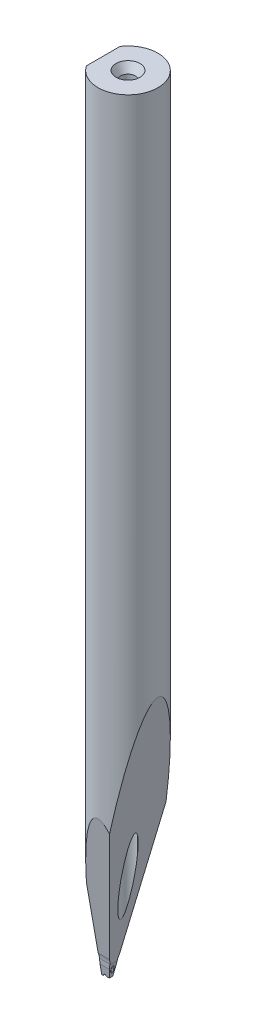
from build123d import *

# Parameters (mm, degrees)
TD_STD_FEATURE_DEPTH            = 21.0312
ISA_STD_FEATURE_DEPTH           = 22.061040395498036
ISA_STD_FEATURE_DEPTH_BACK      = 22.061040395498036
BA_STD_FEATURE_DEPTH            = 22.061040395498036
BA_STD_FEATURE_DEPTH_BACK       = 22.061040395498036
VR_STD_FEATURE_DEPTH            = 22.061040395498036
VR_STD_FEATURE_DEPTH_BACK       = 22.061040395498036
ND_STD_FEATURE_DEPTH            = 22.061040395498036
ND_STD_FEATURE_DEPTH_BACK       = 22.061040395498036
HOLE_STD_FEATURE_D              = 0.381
HOLE_STD_FEATURE_CSINK_D        = 0.635
HOLE_STD_FEATURE_CSINK_ANGLE    = 60
STD_HOLE_CUT_FEATURE_DEPTH      = 22.158574025318714
STD_HOLE_CUT_FEATURE_DEPTH_BACK = 22.158574025318714
NR_FEATURE_R                    = 0.0254
STD_C_FEATURE_DEPTH             = 22.061040395498036
STD_C_FEATURE_DEPTH_BACK        = 22.061040395498036
STD_FR_C_FEATURE_R              = 0.01016
STD_BR_C_FEATURE_R              = 0.01016


with BuildPart() as part:
    # td_std_sketch → td_std_feature (new body)
    with BuildSketch(Plane(origin=(0, 0, 0), x_dir=(1, 0, 0), z_dir=(0, 1, 0))):
        with BuildLine():
            Line((-0.65532, 0.4456234374446657), (-0.6553199999999998, -0.44562343744466604))
            ThreePointArc((-0.6553199999999998, -0.44562343744466604), (0.79248, 0), (-0.65532, 0.4456234374446657))
        make_face()
    extrude(amount=TD_STD_FEATURE_DEPTH)

    # isa_std_sketch → isa_std_feature (cut, two sides: drawn at the far end of the back side and taken through both)
    with BuildSketch(Plane(origin=(0, 0, 0), x_dir=(0, 0, -1), z_dir=(1, 0, 0)).offset(-ISA_STD_FEATURE_DEPTH_BACK)):
        Polygon((8.373162888528082, 47.27049062508045), (0.79248, 4.278301579083286), (0.03809999999999999, 0), (-0.03809999999999999, 0), (-0.79248, 4.278301579083286), (-8.373162888528082, 47.27049062508045), (-8.373162888528082, -40.04033509597618), (8.373162888528082, -40.04033509597618), align=None)
    extrude(amount=ISA_STD_FEATURE_DEPTH + ISA_STD_FEATURE_DEPTH_BACK, mode=Mode.SUBTRACT)

    # ba_std_sketch → ba_std_feature (cut, two sides: drawn at the far end of the back side and taken through both)
    with BuildSketch(Plane.XY.offset(-BA_STD_FEATURE_DEPTH_BACK)):
        Polygon((-51.96869655836785, -9.056666233848073), (-0.6057899999999999, 0), (-0.4471889008518133, 0.02796565294984382), (0.79248, 7.0584773526961735), (9.849146233848053, 58.421383911064034), (86.76310584868799, -12.040863498073982), (24.945263056472086, -79.51891364298609), align=None)
    extrude(amount=BA_STD_FEATURE_DEPTH + BA_STD_FEATURE_DEPTH_BACK, mode=Mode.SUBTRACT)

    # vr_std_sketch → vr_std_feature (cut, two sides: drawn at the far end of the back side and taken through both)
    with BuildSketch(Plane(origin=(0, 0, 0), x_dir=(0, 0, -1), z_dir=(1, 0, 0)).offset(-VR_STD_FEATURE_DEPTH_BACK)):
        with BuildLine():
            Line((35.91518958962539, 36.381828135911775), (0.79248, 1.2591185462865075))
            Line((0.79248, 1.2591185462865075), (0.24587123921628848, 0.7125097855027981))
            ThreePointArc((0.24587123921628848, 0.7125097855027981), (0.14656815960932523, 0.5719991778386461), (0.09986436121197133, 0.40640000000000004))
            Line((0.09986436121197133, 0.40640000000000004), (0.05714999999999999, 0))
            Line((0.05714999999999999, 0), (-0.05714999999999999, 0))
            Line((-0.05714999999999999, 0), (-0.09986436121197133, 0.40640000000000004))
            ThreePointArc((-0.09986436121197133, 0.40640000000000004), (-0.14656815960932523, 0.5719991778386461), (-0.24587123921628848, 0.7125097855027981))
            Line((-0.24587123921628848, 0.7125097855027981), (-0.79248, 1.2591185462865075))
            Line((-0.79248, 1.2591185462865075), (-35.91518958962539, 36.381828135911775))
            Line((-35.91518958962539, 36.381828135911775), (-35.91518958962539, -62.96019636196763))
            Line((-35.91518958962539, -62.96019636196763), (35.91518958962539, -62.96019636196763))
            Line((35.91518958962539, -62.96019636196763), (35.91518958962539, 36.381828135911775))
        make_face()
    extrude(amount=VR_STD_FEATURE_DEPTH + VR_STD_FEATURE_DEPTH_BACK, mode=Mode.SUBTRACT)

    # nd_std_sketch → nd_std_feature (cut, two sides: drawn at the far end of the back side and taken through both)
    with BuildSketch(Plane.XY.offset(-ND_STD_FEATURE_DEPTH_BACK)):
        Polygon((-26.695612432299043, -45.16910067246157), (-0.6172199999999999, 0), (-0.5795900153763918, 0.06517704525612475), (-0.49309651581291747, 0.01523999999999999), (44.67600415664865, -26.06315243229904), (71.65060635143378, -126.82868059585769), (0.27898976248608776, -145.93462883602024), align=None)
    extrude(amount=ND_STD_FEATURE_DEPTH + ND_STD_FEATURE_DEPTH_BACK, mode=Mode.SUBTRACT)

    # hole_std_feature (through all)
    with Locations(Plane(origin=(0, 21.0312, 0), x_dir=(1, 0, 0), z_dir=(0, 1, 0))):
        with Locations((0, 0)):
            CounterSinkHole(HOLE_STD_FEATURE_D / 2, HOLE_STD_FEATURE_CSINK_D / 2, counter_sink_angle=HOLE_STD_FEATURE_CSINK_ANGLE)


with BuildPart() as body_2:
    # std_hole_sketch → std_hole_feature (revolve)
    with BuildSketch(Plane.XY):
        Polygon((2.0643967957346323, 1.16621487026174), (1.318693364519402, 1.9119183014769674), (-0.6066953211391621, -0.01347038418160373), (-0.5932249369575584, -0.02694076836320745), (-0.43560320426536, 0.13068096432899157), align=None)
    revolve(axis=Axis((-0.6066953211391621, -0.01347038418160373, 0), (0.7071067811865462, 0.7071067811865488, 0)))

    # std_hole_cut_sketch → std_hole_cut_feature (cut, two sides: drawn at the far end of the back side and taken through both)
    with BuildSketch(Plane.XY.offset(-STD_HOLE_CUT_FEATURE_DEPTH_BACK)):
        Polygon((-45.98482601113434, 26.27990227002553), (-0.6553199999999999, 0.1088997722642913), (-0.557592970120267, 0.05247704525612475), (-0.49309651581291747, 0.01523999999999999), (44.83640949532142, -26.155762497761245), (-7.505595500201061, -116.81477452002991), (-98.32683100665682, -64.37910975224314), align=None)
    extrude(amount=STD_HOLE_CUT_FEATURE_DEPTH + STD_HOLE_CUT_FEATURE_DEPTH_BACK, mode=Mode.SUBTRACT)


with BuildPart() as part_1:
    add(part.part)

    # std_hole_combine: cut body 2
    add(body_2.part, mode=Mode.SUBTRACT)

    # nr_feature
    nr_feature_edges = [part_1.edges().sort_by_distance(p)[0] for p in [
        (-0.5795900153763918, 0.06517704525612475, 0),
    ]]
    fillet(nr_feature_edges, radius=NR_FEATURE_R)

    # std_c_sketch → std_c_feature (cut, two sides: drawn at the far end of the back side and taken through both)
    with BuildSketch(Plane(origin=(0, 0, 0), x_dir=(0, 0, -1), z_dir=(1, 0, 0)).offset(-STD_C_FEATURE_DEPTH_BACK)):
        with BuildLine():
            Line((51.47071118925243, -8.282224024034191), (0.03810000000000001, -3e-17))
            ThreePointArc((0.03810000000000001, -3e-17), (1e-17, 0.00304799999999997), (-0.03809999999999998, -3e-17))
            Line((-0.03809999999999998, -3e-17), (-51.47071118925243, -8.282224024034191))
            Line((-51.47071118925243, -8.282224024034191), (-51.47071118925243, -112.47260224638451))
            Line((-51.47071118925243, -112.47260224638451), (51.47071118925243, -112.47260224638451))
            Line((51.47071118925243, -112.47260224638451), (51.47071118925243, -8.282224024034191))
        make_face()
    extrude(amount=STD_C_FEATURE_DEPTH + STD_C_FEATURE_DEPTH_BACK, mode=Mode.SUBTRACT)

    # std_fr_c_feature
    std_fr_c_feature_edges = [part_1.edges().sort_by_distance(p)[0] for p in [
        (-0.6553199999999999, 0.003048, 7e-17),
    ]]
    fillet(std_fr_c_feature_edges, radius=STD_FR_C_FEATURE_R)

    # std_br_c_feature
    std_br_c_feature_edges = [part_1.edges().sort_by_distance(p)[0] for p in [
        (-0.6154602363795091, 0.00304799999999997, 2e-17),
    ]]
    fillet(std_br_c_feature_edges, radius=STD_BR_C_FEATURE_R)


solid = part_1.part
